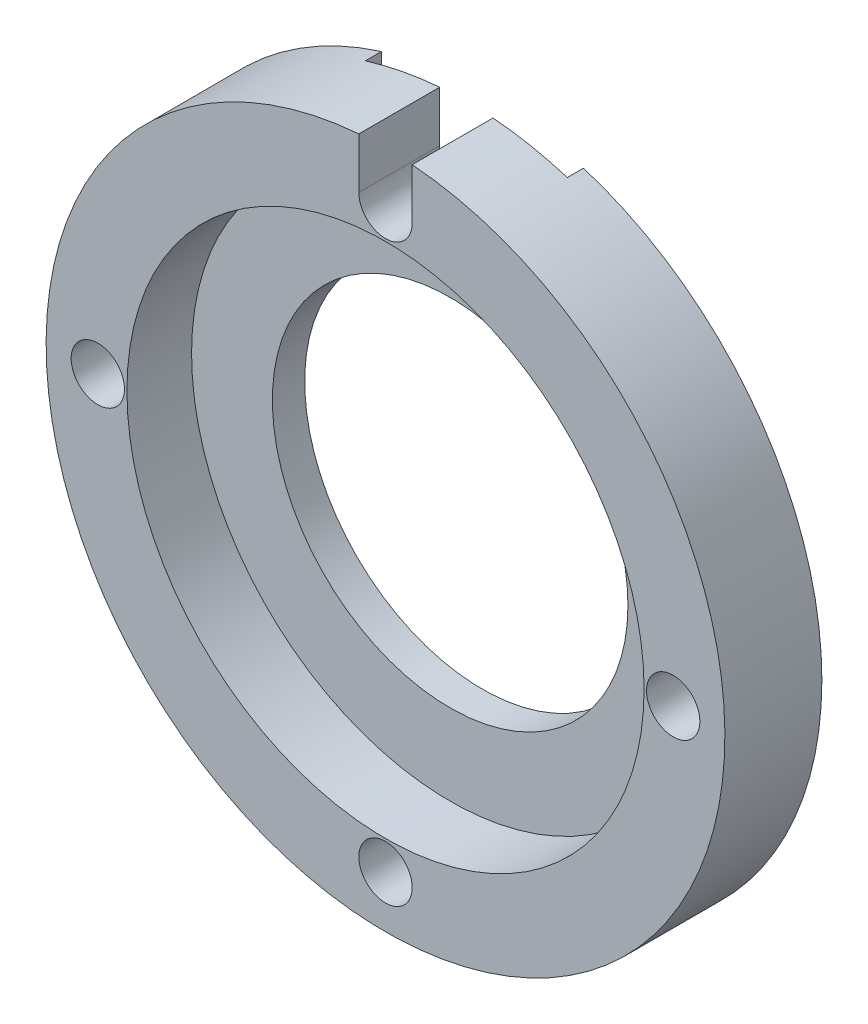
from build123d import *

# Parameters (mm, degrees)
SKETCH_1_R          = 21
SKETCH_1_R_2        = 11
EXTRUDE_1_DEPTH     = 2
SKETCH_2_R          = 21
SKETCH_2_R_2        = 16
EXTRUDE_2_DEPTH     = 4
CUT_EXTRUDE_1_REACH = 32.299
SKETCH_3_R          = 1.65
CUT_EXTRUDE_2_REACH = 32.299
CUT_EXTRUDE_3_DEPTH = 1


with BuildPart() as part:
    # 草图1 → 凸台-拉伸1 (new body)
    with BuildSketch(Plane.XY):
        Circle(SKETCH_1_R)
        Circle(SKETCH_1_R_2, mode=Mode.SUBTRACT)
    extrude(amount=EXTRUDE_1_DEPTH)

    # 草图2 → 凸台-拉伸2 (add)
    with BuildSketch(Plane.XY.offset(2)):
        Circle(SKETCH_2_R)
        Circle(SKETCH_2_R_2, mode=Mode.SUBTRACT)
    extrude(amount=EXTRUDE_2_DEPTH)

    # 草图3 → 切除-拉伸1 (cut, up to next)
    with BuildSketch(Plane.XY.offset(6), mode=Mode.PRIVATE) as cut_extrude_1_sk1:
        with Locations((17.8, 0)):
            Circle(SKETCH_3_R)
    cut_extrude_1_tool1 = extrude(cut_extrude_1_sk1.sketch, amount=-CUT_EXTRUDE_1_REACH, mode=Mode.PRIVATE) & part.part
    # 草图3 → 切除-拉伸1 (cut, up to next)
    with BuildSketch(Plane.XY.offset(6), mode=Mode.PRIVATE) as cut_extrude_1_sk2:
        with Locations((0, -17.8)):
            Circle(SKETCH_3_R)
    cut_extrude_1_tool2 = extrude(cut_extrude_1_sk2.sketch, amount=-CUT_EXTRUDE_1_REACH, mode=Mode.PRIVATE) & part.part
    # 草图3 → 切除-拉伸1 (cut, up to next)
    with BuildSketch(Plane.XY.offset(6), mode=Mode.PRIVATE) as cut_extrude_1_sk3:
        with Locations((-17.8, 0)):
            Circle(SKETCH_3_R)
    cut_extrude_1_tool3 = extrude(cut_extrude_1_sk3.sketch, amount=-CUT_EXTRUDE_1_REACH, mode=Mode.PRIVATE) & part.part
    # 草图3 → 切除-拉伸1 (cut, up to next)
    with BuildSketch(Plane.XY.offset(6), mode=Mode.PRIVATE) as cut_extrude_1_sk4:
        with Locations((0, 17.8)):
            Circle(SKETCH_3_R)
    cut_extrude_1_tool4 = extrude(cut_extrude_1_sk4.sketch, amount=-CUT_EXTRUDE_1_REACH, mode=Mode.PRIVATE) & part.part
    add(cut_extrude_1_tool1.solids().sort_by_distance((17.8, 0, 6))[0], mode=Mode.SUBTRACT)
    add(cut_extrude_1_tool2.solids().sort_by_distance((0, -17.8, 6))[0], mode=Mode.SUBTRACT)
    add(cut_extrude_1_tool3.solids().sort_by_distance((-17.8, 0, 6))[0], mode=Mode.SUBTRACT)
    add(cut_extrude_1_tool4.solids().sort_by_distance((0, 17.8, 6))[0], mode=Mode.SUBTRACT)

    # 草图5 → 切除-拉伸2 (cut, up to next)
    with BuildSketch(Plane.XY.offset(6), mode=Mode.PRIVATE) as cut_extrude_2_sk1:
        with BuildLine():
            Line((-1.65, 17.8), (-1.65, 20.935078218))
            ThreePointArc((-1.65, 20.935078218), (0, 21), (1.65, 20.935078218))
            Line((1.65, 20.935078218), (1.65, 17.8))
            ThreePointArc((1.65, 17.8), (0, 19.45), (-1.65, 17.8))
        make_face()
    cut_extrude_2_tool1 = extrude(cut_extrude_2_sk1.sketch, amount=-CUT_EXTRUDE_2_REACH, mode=Mode.PRIVATE) & part.part
    add(cut_extrude_2_tool1.solids().sort_by_distance((0, 20.001216, 6))[0], mode=Mode.SUBTRACT)

    # 草图6 → 切除-拉伸3 (cut)
    with BuildSketch(Plane(origin=(0, 0, 0), x_dir=(-1, 0, 0), z_dir=(0, 0, -1))):
        with BuildLine():
            Line((-6.25, 9.051933495), (-6.25, 20.048378987))
            ThreePointArc((-6.25, 20.048378987), (0, 21), (6.25, 20.048378987))
            Line((6.25, 20.048378987), (6.25, 9.051933495))
            ThreePointArc((6.25, 9.051933495), (0, 11), (-6.25, 9.051933495))
        make_face()
    extrude(amount=-CUT_EXTRUDE_3_DEPTH, mode=Mode.SUBTRACT)


solid = part.part
